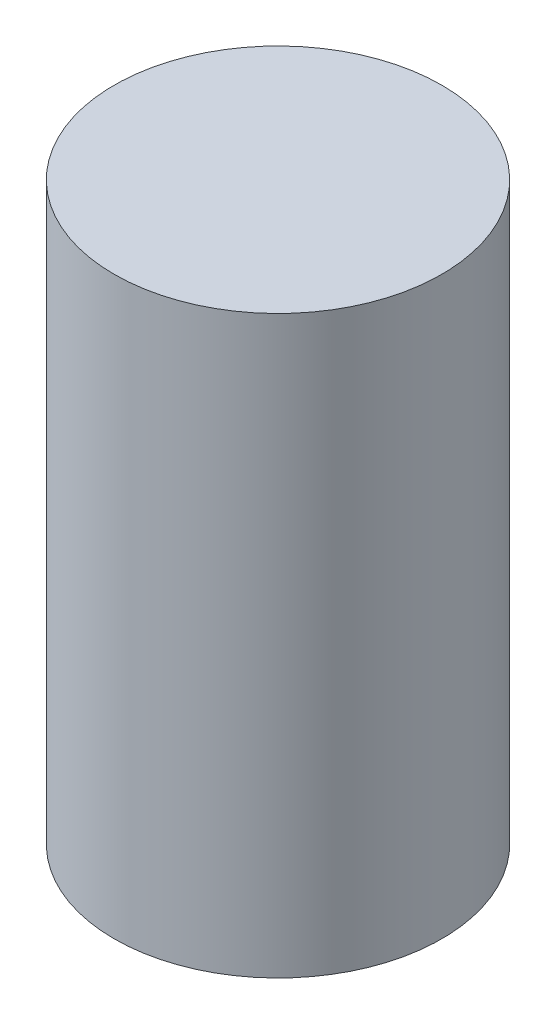
from build123d import *

# Parameters (mm, degrees)
SKETCH1_R           = 86.767352835
BOSS_EXTRUDE1_DEPTH = 304.8


with BuildPart() as part:
    # Sketch1 → Boss-Extrude1 (new body)
    with BuildSketch(Plane(origin=(0, 0, 0), x_dir=(1, 0, 0), z_dir=(0, 1, 0))):
        with Locations(Location((0, 0, 0), (0, 0, 90))):
            Circle(SKETCH1_R)
    extrude(amount=BOSS_EXTRUDE1_DEPTH)


solid = part.part
